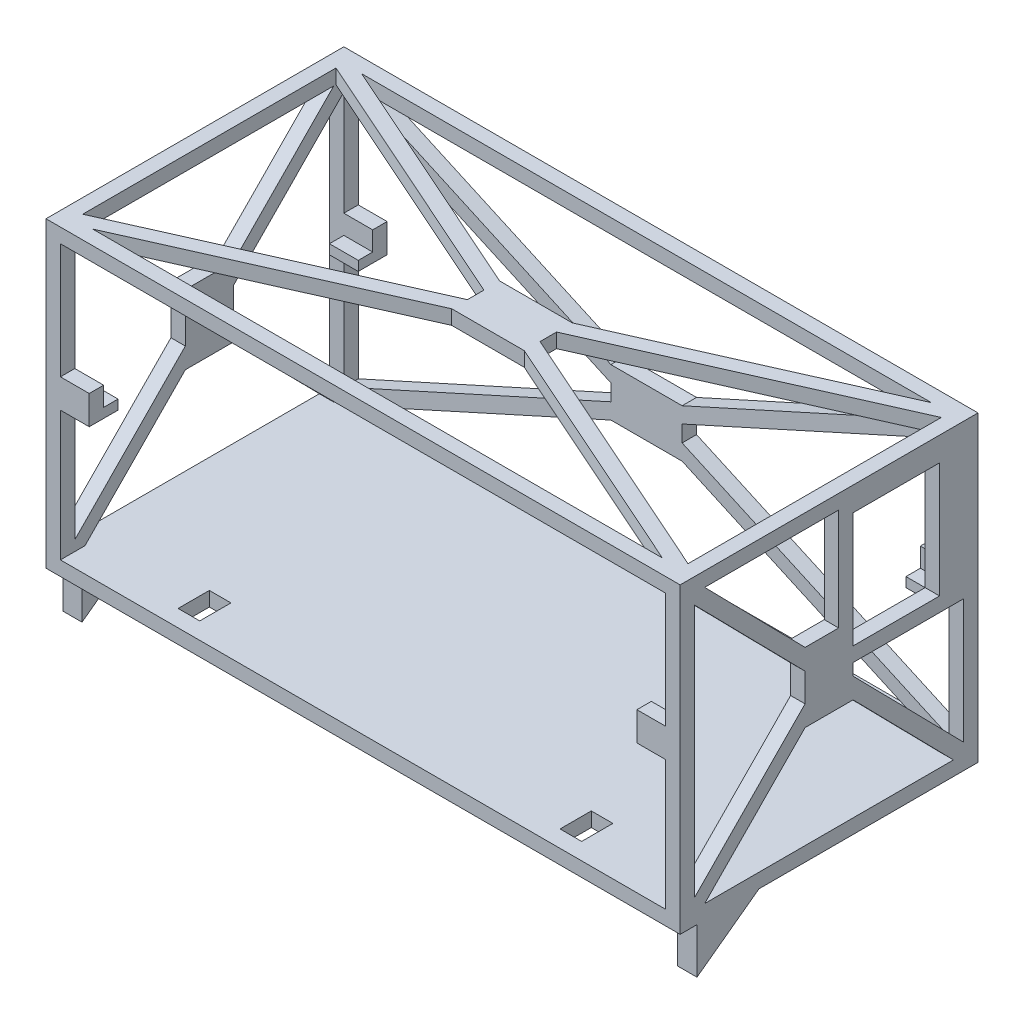
from build123d import *

# Parameters (mm, degrees)
SKETCH1_W                      = 66
SKETCH1_H                      = 31
BOSS_EXTRUDE1_DEPTH            = 31.5
SHELL1_T                       = -1.5
CUT_EXTRUDE1_REACH             = 57.157
CUT_EXTRUDE2_REACH             = 75.435
CUT_EXTRUDE2_DIRECTION_2_REACH = 75.435
SKETCH6_W                      = 3
SKETCH6_H                      = 1.5
BOSS_EXTRUDE4_DEPTH            = 3
SKETCH6_3_W                    = 3
SKETCH6_3_H                    = 1.5
BOSS_EXTRUDE5_DEPTH            = 1
MIRROR3_COPY_1_SKETCH_W        = 3
MIRROR3_COPY_1_SKETCH_H        = 1.5
MIRROR3_COPY_1_DEPTH           = 3
MIRROR3_COPY_2_SKETCH_W        = 3
MIRROR3_COPY_2_SKETCH_H        = 1.5
MIRROR3_COPY_2_DEPTH           = 1
SKETCH7_W                      = 13
SKETCH7_H                      = 14.5
SKETCH7_W_2                    = 9
SKETCH7_H_2                    = 12
BOSS_EXTRUDE8_DEPTH            = 1.5
SKETCH7_4_W                    = 9
SKETCH7_4_H                    = 12
CUT_EXTRUDE5_DEPTH             = 1.5
CUT_EXTRUDE9_REACH             = 49.215
BOSS_EXTRUDE9_DEPTH            = 2
SKETCH12_W                     = 2.25
SKETCH12_H                     = 3.25
CUT_EXTRUDE10_DEPTH            = 1.5


with BuildPart() as part:
    # Sketch1 → Boss-Extrude1 (new body)
    with BuildSketch(Plane(origin=(0, 0, 0), x_dir=(1, 0, 0), z_dir=(0, 1, 0))):
        Rectangle(SKETCH1_W, SKETCH1_H)
    extrude(amount=BOSS_EXTRUDE1_DEPTH)

    # Shell1
    shell1_openings = [part.faces().sort_by_distance(p)[0] for p in [
        (0, 15.75, 15.5),
    ]]
    offset(amount=SHELL1_T, openings=shell1_openings, kind=Kind.INTERSECTION)

    # Sketch3 → Cut-Extrude1 (cut, up to next)
    with BuildSketch(Plane(origin=(0, 0, -15.5), x_dir=(-1, 0, 0), z_dir=(0, 0, -1)), mode=Mode.PRIVATE) as cut_extrude1_sk1:
        Polygon((29.680353068, 1.5), (3.706668857, 13.25), (-3.706668857, 13.25), (-29.680353068, 1.5), align=None)
    cut_extrude1_tool1 = extrude(cut_extrude1_sk1.sketch, amount=-CUT_EXTRUDE1_REACH, mode=Mode.PRIVATE) & part.part
    # Sketch3 → Cut-Extrude1 (cut, up to next)
    with BuildSketch(Plane(origin=(0, 0, -15.5), x_dir=(-1, 0, 0), z_dir=(0, 0, -1)), mode=Mode.PRIVATE) as cut_extrude1_sk2:
        Polygon((3.706668857, 16.603652775), (3.706668857, 14.896347225), (31.5, 2.323173612), (31.5, 29.176826388), align=None)
    cut_extrude1_tool2 = extrude(cut_extrude1_sk2.sketch, amount=-CUT_EXTRUDE1_REACH, mode=Mode.PRIVATE) & part.part
    # Sketch3 → Cut-Extrude1 (cut, up to next)
    with BuildSketch(Plane(origin=(0, 0, -15.5), x_dir=(-1, 0, 0), z_dir=(0, 0, -1)), mode=Mode.PRIVATE) as cut_extrude1_sk3:
        Polygon((-31.5, 2.323173612), (-3.706668857, 14.896347225), (-3.706668857, 16.603652775), (-31.5, 29.176826388), align=None)
    cut_extrude1_tool3 = extrude(cut_extrude1_sk3.sketch, amount=-CUT_EXTRUDE1_REACH, mode=Mode.PRIVATE) & part.part
    # Sketch3 → Cut-Extrude1 (cut, up to next)
    with BuildSketch(Plane(origin=(0, 0, -15.5), x_dir=(-1, 0, 0), z_dir=(0, 0, -1)), mode=Mode.PRIVATE) as cut_extrude1_sk4:
        Polygon((-3.706668857, 18.25), (3.706668857, 18.25), (29.680353068, 30), (-29.680353068, 30), align=None)
    cut_extrude1_tool4 = extrude(cut_extrude1_sk4.sketch, amount=-CUT_EXTRUDE1_REACH, mode=Mode.PRIVATE) & part.part
    add(cut_extrude1_tool1.solids().sort_by_distance((0, 5.8515, -15.5))[0], mode=Mode.SUBTRACT)
    add(cut_extrude1_tool2.solids().sort_by_distance((-21.68175, 15.75, -15.5))[0], mode=Mode.SUBTRACT)
    add(cut_extrude1_tool3.solids().sort_by_distance((21.68175, 15.75, -15.5))[0], mode=Mode.SUBTRACT)
    add(cut_extrude1_tool4.solids().sort_by_distance((0, 25.6485, -15.5))[0], mode=Mode.SUBTRACT)

    # Sketch4 → Cut-Extrude2 (cut, up to next)
    with BuildSketch(Plane(origin=(-31.5, 0, 0), x_dir=(0, 0, -1), z_dir=(1, 0, 0)), mode=Mode.PRIVATE) as cut_extrude2_sk1:
        Polygon((-2.5, 17.224470603), (-14, 28.929827745), (-14, 2.570172255), (-2.5, 14.275529397), align=None)
    cut_extrude2_tool1 = extrude(cut_extrude2_sk1.sketch, amount=-CUT_EXTRUDE2_REACH, mode=Mode.PRIVATE) & part.part
    # Sketch4 → Cut-Extrude2 (cut, up to next)
    with BuildSketch(Plane(origin=(-31.5, 0, 0), x_dir=(0, 0, -1), z_dir=(1, 0, 0)), mode=Mode.PRIVATE) as cut_extrude2_sk2:
        Polygon((12.948602697, 30), (-12.948602697, 30), (-2.5, 19.364815112), (2.5, 19.364815112), align=None)
    cut_extrude2_tool2 = extrude(cut_extrude2_sk2.sketch, amount=-CUT_EXTRUDE2_REACH, mode=Mode.PRIVATE) & part.part
    # Sketch4 → Cut-Extrude2 (cut, up to next)
    with BuildSketch(Plane(origin=(-31.5, 0, 0), x_dir=(0, 0, -1), z_dir=(1, 0, 0)), mode=Mode.PRIVATE) as cut_extrude2_sk3:
        Polygon((-2.5, 12.135184888), (-12.948602697, 1.5), (12.948602697, 1.5), (2.5, 12.135184888), align=None)
    cut_extrude2_tool3 = extrude(cut_extrude2_sk3.sketch, amount=-CUT_EXTRUDE2_REACH, mode=Mode.PRIVATE) & part.part
    # Sketch4 → Cut-Extrude2 (cut, up to next)
    with BuildSketch(Plane(origin=(-31.5, 0, 0), x_dir=(0, 0, -1), z_dir=(1, 0, 0)), mode=Mode.PRIVATE) as cut_extrude2_sk4:
        Polygon((14, 28.929827745), (2.5, 17.224470603), (2.5, 14.275529397), (14, 2.570172255), align=None)
    cut_extrude2_tool4 = extrude(cut_extrude2_sk4.sketch, amount=-CUT_EXTRUDE2_REACH, mode=Mode.PRIVATE) & part.part
    add(cut_extrude2_tool1.solids().sort_by_distance((-31.5, 15.75, 9.780968))[0], mode=Mode.SUBTRACT)
    add(cut_extrude2_tool2.solids().sort_by_distance((-31.5, 25.881252, 0))[0], mode=Mode.SUBTRACT)
    add(cut_extrude2_tool3.solids().sort_by_distance((-31.5, 5.618748, 0))[0], mode=Mode.SUBTRACT)
    add(cut_extrude2_tool4.solids().sort_by_distance((-31.5, 15.75, -9.780968))[0], mode=Mode.SUBTRACT)

    # Sketch4 → Cut-Extrude2 direction 2 (cut, up to next)
    with BuildSketch(Plane(origin=(-31.5, 0, 0), x_dir=(0, 0, -1), z_dir=(1, 0, 0)), mode=Mode.PRIVATE) as cut_extrude2_direction_2_sk1:
        Polygon((-2.5, 17.224470603), (-14, 28.929827745), (-14, 2.570172255), (-2.5, 14.275529397), align=None)
    cut_extrude2_direction_2_tool1 = extrude(cut_extrude2_direction_2_sk1.sketch, amount=CUT_EXTRUDE2_DIRECTION_2_REACH, mode=Mode.PRIVATE) & part.part
    # Sketch4 → Cut-Extrude2 direction 2 (cut, up to next)
    with BuildSketch(Plane(origin=(-31.5, 0, 0), x_dir=(0, 0, -1), z_dir=(1, 0, 0)), mode=Mode.PRIVATE) as cut_extrude2_direction_2_sk2:
        Polygon((12.948602697, 30), (-12.948602697, 30), (-2.5, 19.364815112), (2.5, 19.364815112), align=None)
    cut_extrude2_direction_2_tool2 = extrude(cut_extrude2_direction_2_sk2.sketch, amount=CUT_EXTRUDE2_DIRECTION_2_REACH, mode=Mode.PRIVATE) & part.part
    # Sketch4 → Cut-Extrude2 direction 2 (cut, up to next)
    with BuildSketch(Plane(origin=(-31.5, 0, 0), x_dir=(0, 0, -1), z_dir=(1, 0, 0)), mode=Mode.PRIVATE) as cut_extrude2_direction_2_sk3:
        Polygon((-2.5, 12.135184888), (-12.948602697, 1.5), (12.948602697, 1.5), (2.5, 12.135184888), align=None)
    cut_extrude2_direction_2_tool3 = extrude(cut_extrude2_direction_2_sk3.sketch, amount=CUT_EXTRUDE2_DIRECTION_2_REACH, mode=Mode.PRIVATE) & part.part
    # Sketch4 → Cut-Extrude2 direction 2 (cut, up to next)
    with BuildSketch(Plane(origin=(-31.5, 0, 0), x_dir=(0, 0, -1), z_dir=(1, 0, 0)), mode=Mode.PRIVATE) as cut_extrude2_direction_2_sk4:
        Polygon((14, 28.929827745), (2.5, 17.224470603), (2.5, 14.275529397), (14, 2.570172255), align=None)
    cut_extrude2_direction_2_tool4 = extrude(cut_extrude2_direction_2_sk4.sketch, amount=CUT_EXTRUDE2_DIRECTION_2_REACH, mode=Mode.PRIVATE) & part.part
    add(cut_extrude2_direction_2_tool1.solids().sort_by_distance((-31.5, 15.75, 9.780968))[0], mode=Mode.SUBTRACT)
    add(cut_extrude2_direction_2_tool2.solids().sort_by_distance((-31.5, 25.881252, 0))[0], mode=Mode.SUBTRACT)
    add(cut_extrude2_direction_2_tool3.solids().sort_by_distance((-31.5, 5.618748, 0))[0], mode=Mode.SUBTRACT)
    add(cut_extrude2_direction_2_tool4.solids().sort_by_distance((-31.5, 15.75, -9.780968))[0], mode=Mode.SUBTRACT)

    # Sketch6 → Boss-Extrude4 (add)
    with BuildSketch(Plane(origin=(0, 15, 0), x_dir=(-1, 0, 0), z_dir=(0, -1, 0))):
        with Locations((-30, 14.75)):
            Rectangle(SKETCH6_W, SKETCH6_H)
    boss_extrude4 = extrude(amount=-BOSS_EXTRUDE4_DEPTH)

    # Sketch6<3> → Boss-Extrude5 (add)
    with BuildSketch(Plane(origin=(0, 15, 0), x_dir=(-1, 0, 0), z_dir=(0, -1, 0))):
        with Locations((-30, 13.25)):
            Rectangle(SKETCH6_3_W, SKETCH6_3_H)
    boss_extrude5 = extrude(amount=-BOSS_EXTRUDE5_DEPTH)

    # Mirror2: Boss-Extrude4, Boss-Extrude5 across plane
    add(boss_extrude4.mirror(Plane.XY))
    add(boss_extrude5.mirror(Plane.XY))

    # Mirror3: Boss-Extrude4, Boss-Extrude5 across plane
    add(boss_extrude4.mirror(Plane.ZY))
    add(boss_extrude5.mirror(Plane.ZY))

    # Mirror3 copy 1 sketch → Mirror3 copy 1 (add)
    with BuildSketch(Plane.XZ.offset(-15)):
        with Locations((-30, 14.75)):
            Rectangle(MIRROR3_COPY_1_SKETCH_W, MIRROR3_COPY_1_SKETCH_H)
    extrude(amount=-MIRROR3_COPY_1_DEPTH)

    # Mirror3 copy 2 sketch → Mirror3 copy 2 (add)
    with BuildSketch(Plane.XZ.offset(-15)):
        with Locations((-30, 13.25)):
            Rectangle(MIRROR3_COPY_2_SKETCH_W, MIRROR3_COPY_2_SKETCH_H)
    extrude(amount=-MIRROR3_COPY_2_DEPTH)

    # Sketch7 → Boss-Extrude8 (add)
    with BuildSketch(Plane(origin=(31.5, 0, 0), x_dir=(0, 0, -1), z_dir=(1, 0, 0))):
        with Locations((7.5, 22.75)):
            Rectangle(SKETCH7_W, SKETCH7_H)
        with Locations((7, 23)):
            Rectangle(SKETCH7_W_2, SKETCH7_H_2, mode=Mode.SUBTRACT)
    extrude(amount=BOSS_EXTRUDE8_DEPTH)

    # Sketch7<4> → Cut-Extrude5 (cut)
    with BuildSketch(Plane(origin=(31.5, 0, 0), x_dir=(0, 0, -1), z_dir=(1, 0, 0))):
        with Locations((7, 23)):
            Rectangle(SKETCH7_4_W, SKETCH7_4_H)
    extrude(amount=CUT_EXTRUDE5_DEPTH, mode=Mode.SUBTRACT)

    # Sketch10 → Cut-Extrude9 (cut, up to next)
    with BuildSketch(Plane.XZ.offset(-30), mode=Mode.PRIVATE) as cut_extrude9_sk1:
        Polygon((-31.5, -13.17926185), (-3.778339162, -0.8585237), (-3.778339162, 0.8585237), (-31.5, 13.17926185), (-31.5, 12.948602697), (-31.5, -12.948602697), align=None)
    cut_extrude9_tool1 = extrude(cut_extrude9_sk1.sketch, amount=-CUT_EXTRUDE9_REACH, mode=Mode.PRIVATE) & part.part
    # Sketch10 → Cut-Extrude9 (cut, up to next)
    with BuildSketch(Plane.XZ.offset(-30), mode=Mode.PRIVATE) as cut_extrude9_sk2:
        Polygon((-3.778339162, 2.5), (3.778339162, 2.5), (29.653339162, 14), (-29.653339162, 14), align=None)
    cut_extrude9_tool2 = extrude(cut_extrude9_sk2.sketch, amount=-CUT_EXTRUDE9_REACH, mode=Mode.PRIVATE) & part.part
    # Sketch10 → Cut-Extrude9 (cut, up to next)
    with BuildSketch(Plane.XZ.offset(-30), mode=Mode.PRIVATE) as cut_extrude9_sk3:
        Polygon((3.778339162, 0.8585237), (3.778339162, -0.8585237), (31.5, -13.17926185), (31.5, -1), (31.5, 12.948602697), (31.5, 13.17926185), align=None)
    cut_extrude9_tool3 = extrude(cut_extrude9_sk3.sketch, amount=-CUT_EXTRUDE9_REACH, mode=Mode.PRIVATE) & part.part
    # Sketch10 → Cut-Extrude9 (cut, up to next)
    with BuildSketch(Plane.XZ.offset(-30), mode=Mode.PRIVATE) as cut_extrude9_sk4:
        Polygon((29.653339162, -14), (3.778339162, -2.5), (-3.778339162, -2.5), (-29.653339162, -14), align=None)
    cut_extrude9_tool4 = extrude(cut_extrude9_sk4.sketch, amount=-CUT_EXTRUDE9_REACH, mode=Mode.PRIVATE) & part.part
    add(cut_extrude9_tool1.solids().sort_by_distance((-21.694312, 30, 0))[0], mode=Mode.SUBTRACT)
    add(cut_extrude9_tool2.solids().sort_by_distance((0, 30, 9.733436))[0], mode=Mode.SUBTRACT)
    add(cut_extrude9_tool3.solids().sort_by_distance((21.694312, 30, 0))[0], mode=Mode.SUBTRACT)
    add(cut_extrude9_tool4.solids().sort_by_distance((0, 30, -9.733436))[0], mode=Mode.SUBTRACT)

    # Sketch11 → Boss-Extrude9 (add)
    with BuildSketch(Plane.ZY.offset(33)):
        Polygon((13.75, 0), (7.294759025, 0), (13.75, -4.738684311), align=None)
    boss_extrude9 = extrude(amount=-BOSS_EXTRUDE9_DEPTH)

    # Mirror5: Boss-Extrude9 across plane
    add(boss_extrude9.mirror(Plane.ZY))

    # Sketch12 → Cut-Extrude10 (cut)
    with BuildSketch(Plane.XZ):
        with Locations((-19.875, 12.125)):
            Rectangle(SKETCH12_W, SKETCH12_H)
        with Locations((19.875, 12.125)):
            Rectangle(SKETCH12_W, SKETCH12_H)
    extrude(amount=-CUT_EXTRUDE10_DEPTH, mode=Mode.SUBTRACT)


solid = part.part
